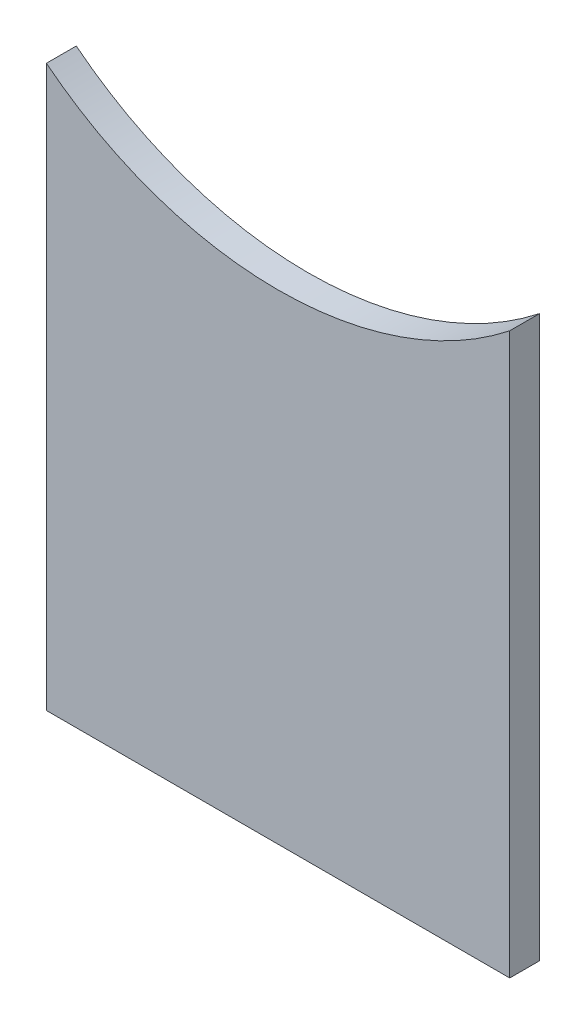
from build123d import *

# Parameters (mm, degrees)
EXTRUDE_1_DEPTH = 8


with BuildPart() as part:
    # 草图4 → 凸台-拉伸1 (new body)
    with BuildSketch(Plane.XY):
        with BuildLine():
            Line((31.183136193, -53.203860882), (155.183136193, -53.203860882))
            Line((155.183136193, -53.203860882), (155.183136193, 96.796139118))
            ThreePointArc((155.183136193, 96.796139118), (93.183136193, 75.256320101), (31.183136193, 96.796139118))
            Line((31.183136193, 96.796139118), (31.183136193, -53.203860882))
        make_face()
    extrude(amount=EXTRUDE_1_DEPTH)


solid = part.part
